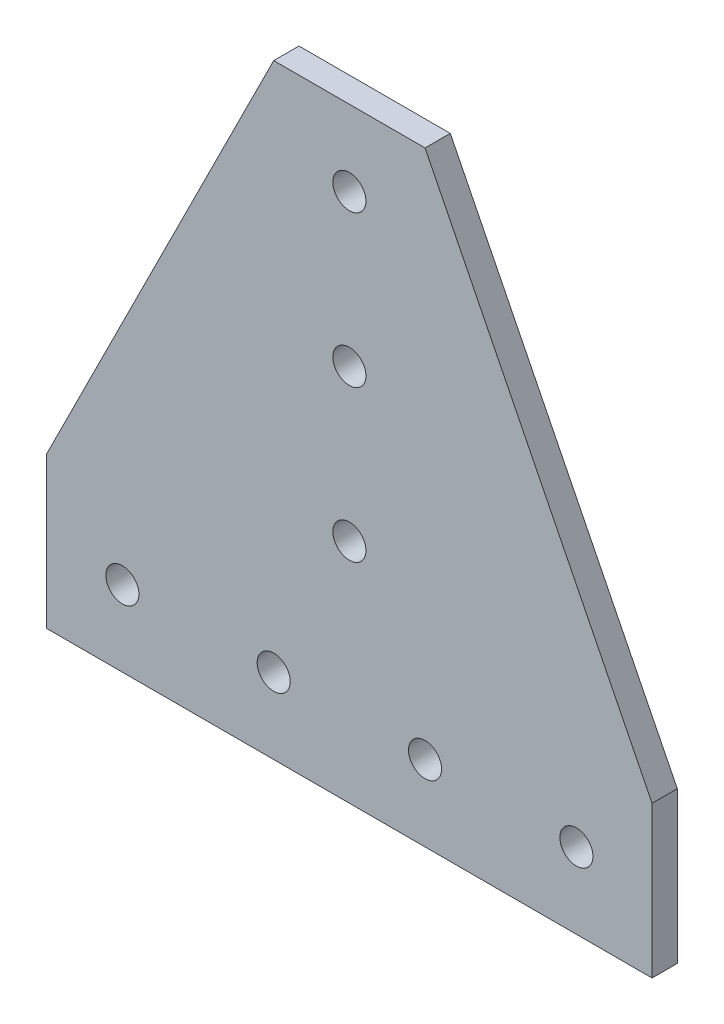
from build123d import *

# Parameters (mm, degrees)
SKETCH1_R           = 4.1656
BOSS_EXTRUDE2_DEPTH = 6.35


with BuildPart() as part:
    # Sketch1 → Boss-Extrude2 (new body)
    with BuildSketch(Plane.XY):
        Polygon((0, 0), (0, 38.1), (57.15, 152.4), (95.25, 152.4), (152.4, 38.1), (152.4, 0), align=None)
        with Locations((19.05, 19.05)):
            Circle(SKETCH1_R, mode=Mode.SUBTRACT)
        with Locations((57.15, 19.05)):
            Circle(SKETCH1_R, mode=Mode.SUBTRACT)
        with Locations((95.25, 19.05)):
            Circle(SKETCH1_R, mode=Mode.SUBTRACT)
        with Locations((133.35, 19.05)):
            Circle(SKETCH1_R, mode=Mode.SUBTRACT)
        with Locations((76.2, 133.35)):
            Circle(SKETCH1_R, mode=Mode.SUBTRACT)
        with Locations((76.2, 95.25)):
            Circle(SKETCH1_R, mode=Mode.SUBTRACT)
        with Locations((76.2, 57.15)):
            Circle(SKETCH1_R, mode=Mode.SUBTRACT)
    extrude(amount=BOSS_EXTRUDE2_DEPTH)


solid = part.part
